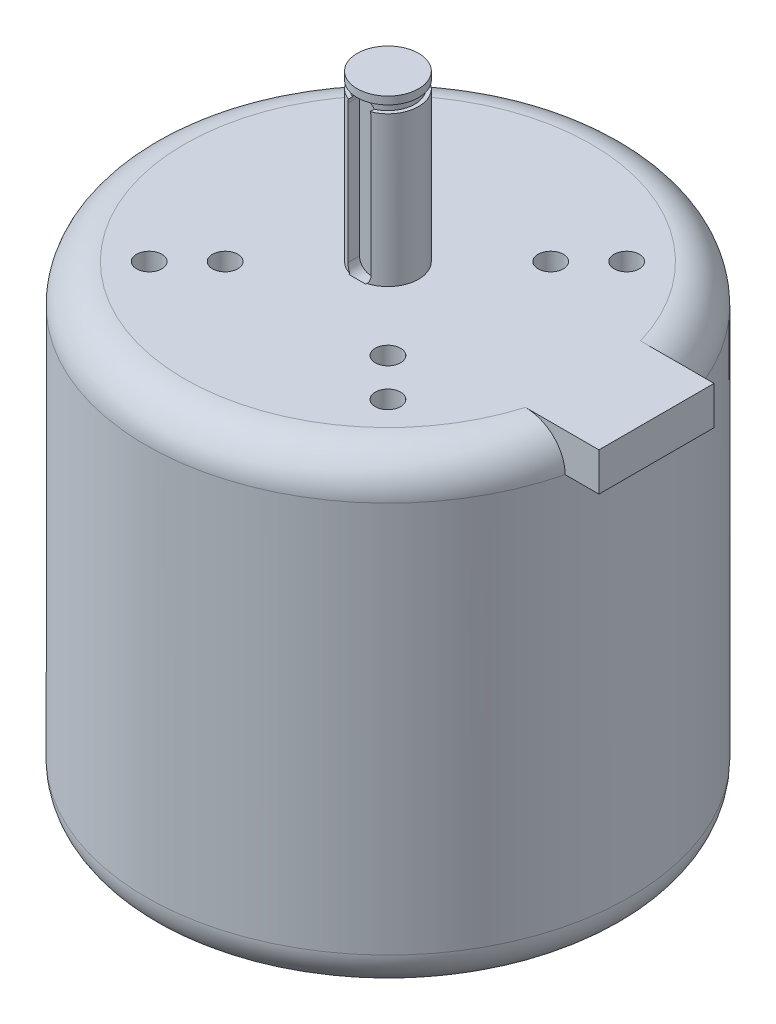
from build123d import *

# Parameters (mm, degrees)
FILLET_1_R         = 5
SKETCH_3_W         = 15
SKETCH_3_H         = 5
EXTRUDE_1_DEPTH    = 35
M4X0_7_1_D         = 3.3
M4X0_7_1_DEPTH     = 11.5
M4X0_7_1_TIP       = 0.991420021
SKETCH_6_W         = 0.5
SKETCH_6_H         = 1
CUT_EXTRUDE1_DEPTH = 1.8


with BuildPart() as part:
    # 스케치1 → 회전1 (revolve)
    with BuildSketch(Plane.XY, mode=Mode.PRIVATE) as revolve_1_sk:
        Polygon((0, 82.5), (4, 82.5), (4, 61), (31.5, 61), (31.5, 0), (0, 0), align=None)
    revolve(revolve_1_sk.sketch.rotate(Axis((0, 0, 0), (0, 1, 0)), 90), axis=Axis((0, 0, 0), (0, 1, 0)))

    # 필렛1
    fillet_1_edges = [part.edges().sort_by_distance(p)[0] for p in [
        (0, 0, 31.5),
        (0, 61, 31.5),
    ]]
    fillet(fillet_1_edges, radius=FILLET_1_R)

    # 스케치3 → 보스-돌출1 (add)
    with BuildSketch(Plane(origin=(0, 0, 0), x_dir=(0, 0, -1), z_dir=(1, 0, 0))):
        with Locations((0, 58.5)):
            Rectangle(SKETCH_3_W, SKETCH_3_H)
    extrude(amount=EXTRUDE_1_DEPTH)

    # M4x0.7 나사 구멍1
    with Locations(Plane(origin=(0, 61, 0), x_dir=(1, 0, 0), z_dir=(0, 1, 0))):
        with Locations((10.606601718, 10.606601718), (15.556349186, 15.556349186), (10.606601718, -10.606601718), (15.556349186, -15.556349186), (-10.606601718, -10.606601718), (-15.556349186, -15.556349186), (-10.606601718, 10.606601718), (-15.556349186, 15.556349186)):
            Hole(M4X0_7_1_D / 2, depth=M4X0_7_1_DEPTH)
            with Locations((0, 0, -(M4X0_7_1_DEPTH + M4X0_7_1_TIP / 2))):  # 118° drill point
                Cone(0, M4X0_7_1_D / 2, M4X0_7_1_TIP, mode=Mode.SUBTRACT)

    # 스케치6 → 컷-회전1 (revolve, cut)
    with BuildSketch(Plane(origin=(0, 0, 0), x_dir=(0, 0, -1), z_dir=(1, 0, 0))):
        with Locations((3.75, 81)):
            Rectangle(SKETCH_6_W, SKETCH_6_H)
    revolve(axis=Axis((0, 82.5, 0), (0, -1, 0)), mode=Mode.SUBTRACT)

    # Sketch3 → Cut-Extrude1 (cut)
    with BuildSketch(Plane(origin=(2.845698698, 82.5, 4), x_dir=(0, 1, 0), z_dir=(0, 0, -1))):
        with BuildLine():
            Line((-2.5, -1.345698698), (-20.5, -1.345698698))
            ThreePointArc((-20.5, -1.345698698), (-22, -2.845698698), (-20.5, -4.345698698))
            Line((-20.5, -4.345698698), (-2.5, -4.345698698))
            ThreePointArc((-2.5, -4.345698698), (-1, -2.845698698), (-2.5, -1.345698698))
        make_face()
    extrude(amount=CUT_EXTRUDE1_DEPTH, mode=Mode.SUBTRACT)


solid = part.part
